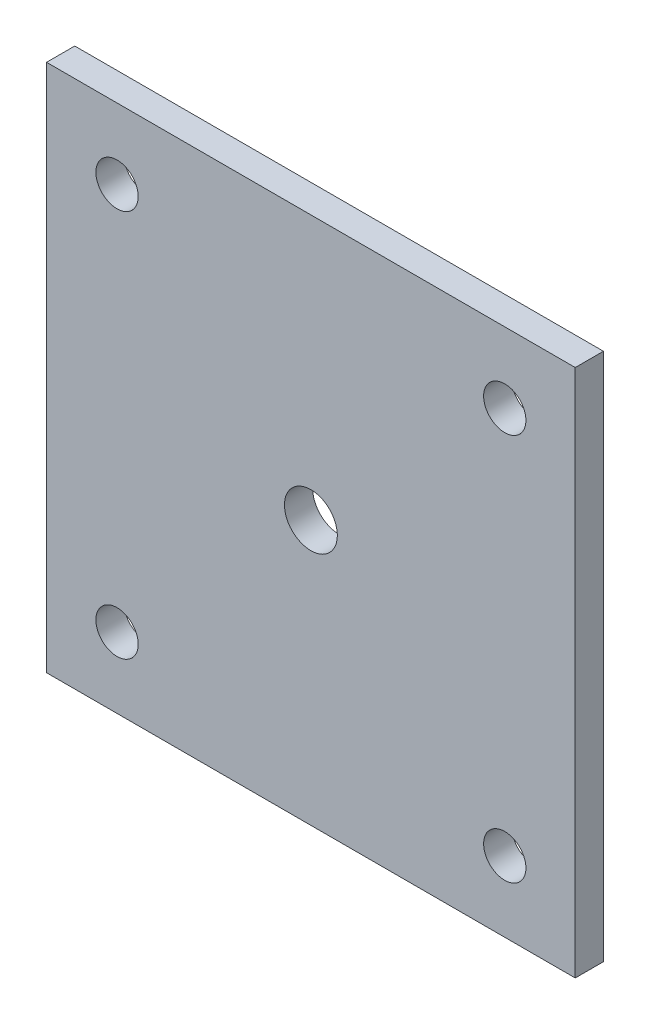
from build123d import *

# Parameters (mm, degrees)
SKETCH1_W           = 150
SKETCH1_H           = 150
BOSS_EXTRUDE1_DEPTH = 8
SKETCH2_R           = 6
CUT_EXTRUDE1_DEPTH  = 107.367288205
SKETCH3_R           = 7.5
CUT_EXTRUDE2_DEPTH  = 107.367288205


with BuildPart() as part:
    # Sketch1 → Boss-Extrude1 (new body)
    with BuildSketch(Plane(origin=(0, 0, 0), x_dir=(0, 1, 0), z_dir=(0, 0, 1))):
        Rectangle(SKETCH1_W, SKETCH1_H)
    extrude(amount=BOSS_EXTRUDE1_DEPTH)

    # Sketch2 → Cut-Extrude1 (cut, through all)
    with BuildSketch(Plane(origin=(0, 0, 0), x_dir=(0, 1, 0), z_dir=(0, 0, 1))):
        with Locations(Location((-55, 55, 0), (0, 0, 270))):
            Circle(SKETCH2_R)
        with Locations(Location((55, 55, 0), (0, 0, 270))):
            Circle(SKETCH2_R)
        with Locations(Location((-55, -55, 0), (0, 0, 270))):
            Circle(SKETCH2_R)
        with Locations(Location((55, -55, 0), (0, 0, 270))):
            Circle(SKETCH2_R)
    extrude(amount=CUT_EXTRUDE1_DEPTH, mode=Mode.SUBTRACT)

    # Sketch3 → Cut-Extrude2 (cut, through all)
    with BuildSketch(Plane(origin=(0, 0, 0), x_dir=(0, 1, 0), z_dir=(0, 0, 1))):
        with Locations(Location((0, 0, 0), (0, 0, 270))):
            Circle(SKETCH3_R)
    extrude(amount=CUT_EXTRUDE2_DEPTH, mode=Mode.SUBTRACT)


solid = part.part
